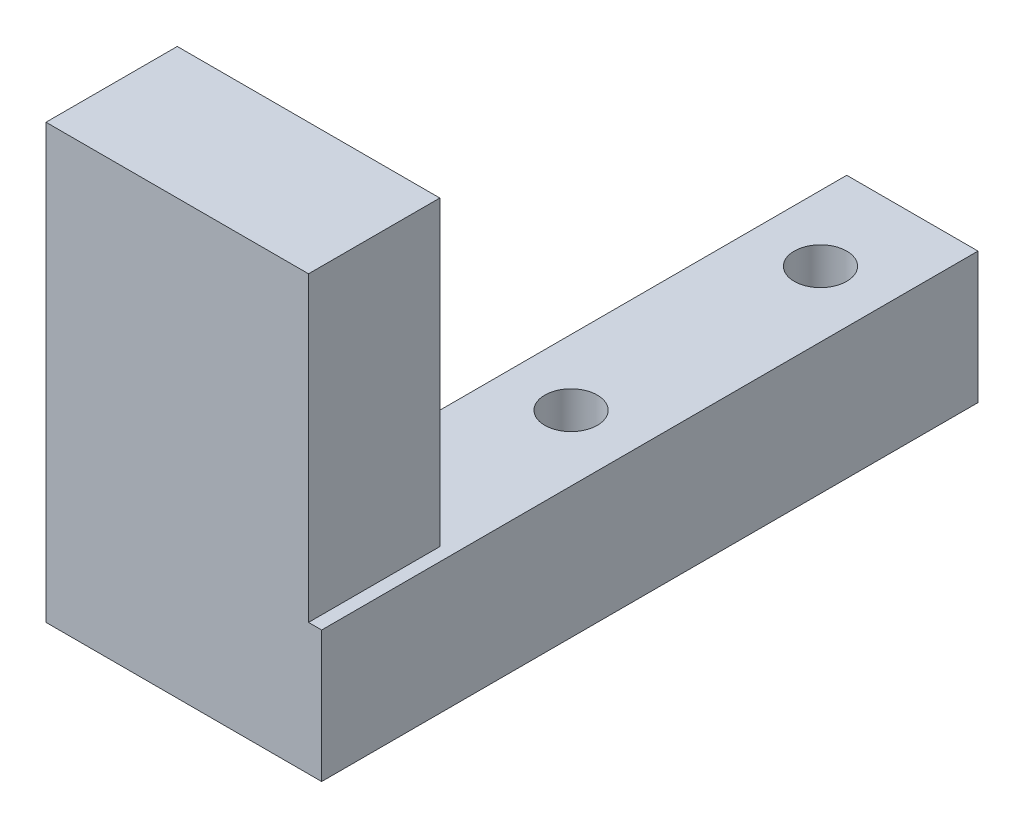
from build123d import *

# Parameters (mm, degrees)
SKETCH1_W           = 10
SKETCH1_H           = 10
BOSS_EXTRUDE1_DEPTH = 50
SKETCH3_W           = 10
SKETCH3_H           = 10
BOSS_EXTRUDE3_DEPTH = 11
SKETCH8_W           = 20
SKETCH8_H           = 10
BOSS_EXTRUDE4_DEPTH = 23
SKETCH9_R           = 2
CUT_EXTRUDE2_DEPTH  = 23
SKETCH9_4_R         = 2
CUT_EXTRUDE3_DEPTH  = 23


with BuildPart() as part:
    # Sketch1 → Boss-Extrude1 (new body)
    with BuildSketch(Plane.XY):
        with Locations((-2.851282988, -1.356707317)):
            Rectangle(SKETCH1_W, SKETCH1_H)
    extrude(amount=BOSS_EXTRUDE1_DEPTH)

    # Sketch3 → Boss-Extrude3 (add)
    with BuildSketch(Plane.ZY.offset(7.851282988)):
        with Locations((45, -1.356707317)):
            Rectangle(SKETCH3_W, SKETCH3_H)
    extrude(amount=BOSS_EXTRUDE3_DEPTH)

    # Sketch8 → Boss-Extrude4 (add)
    with BuildSketch(Plane(origin=(0, 3.643292683, 0), x_dir=(1, 0, 0), z_dir=(0, 1, 0))):
        with Locations((-8.851282988, -45)):
            Rectangle(SKETCH8_W, SKETCH8_H)
    extrude(amount=BOSS_EXTRUDE4_DEPTH)

    # Sketch9 → Cut-Extrude2 (cut)
    with BuildSketch(Plane(origin=(0, 3.643292683, 0), x_dir=(1, 0, 0), z_dir=(0, 1, 0))):
        with Locations((-2.851282988, -7)):
            Circle(SKETCH9_R)
    extrude(amount=-CUT_EXTRUDE2_DEPTH, mode=Mode.SUBTRACT)

    # Sketch9<4> → Cut-Extrude3 (cut)
    with BuildSketch(Plane(origin=(0, 3.643292683, 0), x_dir=(1, 0, 0), z_dir=(0, 1, 0))):
        with Locations((-2.851282988, -26)):
            Circle(SKETCH9_4_R)
    extrude(amount=-CUT_EXTRUDE3_DEPTH, mode=Mode.SUBTRACT)


solid = part.part
